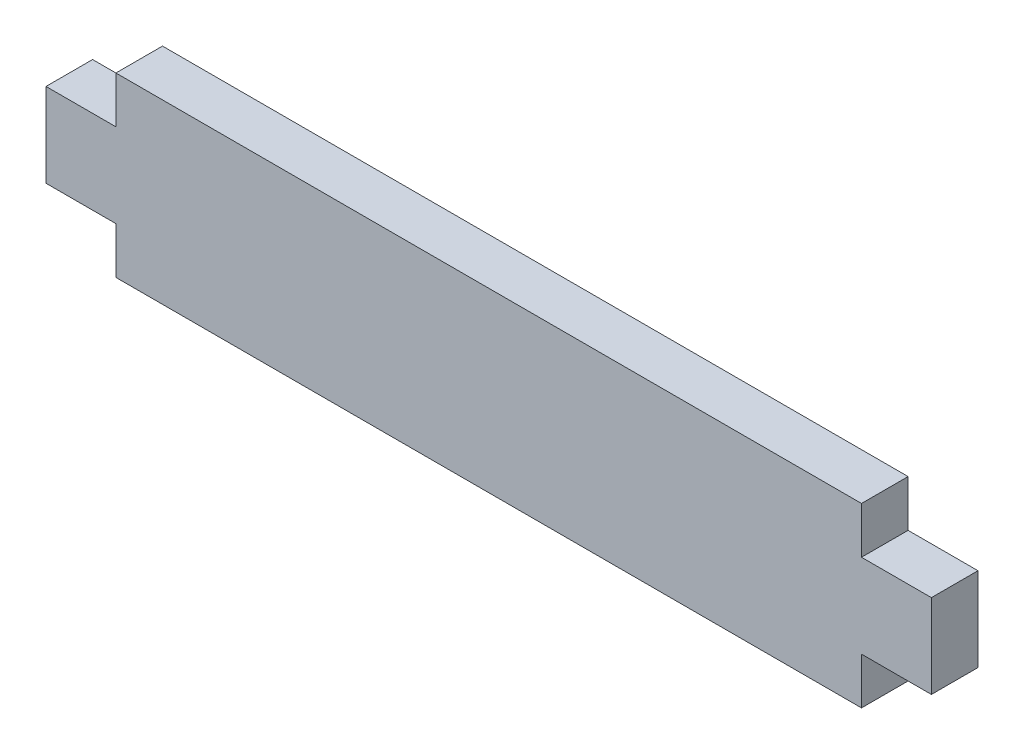
from build123d import *

# Parameters (mm, degrees)
BOSS_EXTRUDE1_DEPTH = 5


with BuildPart() as part:
    # Sketch2 → Boss-Extrude1 (new body)
    with BuildSketch(Plane.XY):
        Polygon((0, -14), (0, -19), (-80, -19), (-80, -14), (-87.5, -14), (-87.5, -5), (-80, -5), (-80, 0), (0, 0), (0, -5), (7.5, -5), (7.5, -14), align=None)
    extrude(amount=BOSS_EXTRUDE1_DEPTH)


solid = part.part
